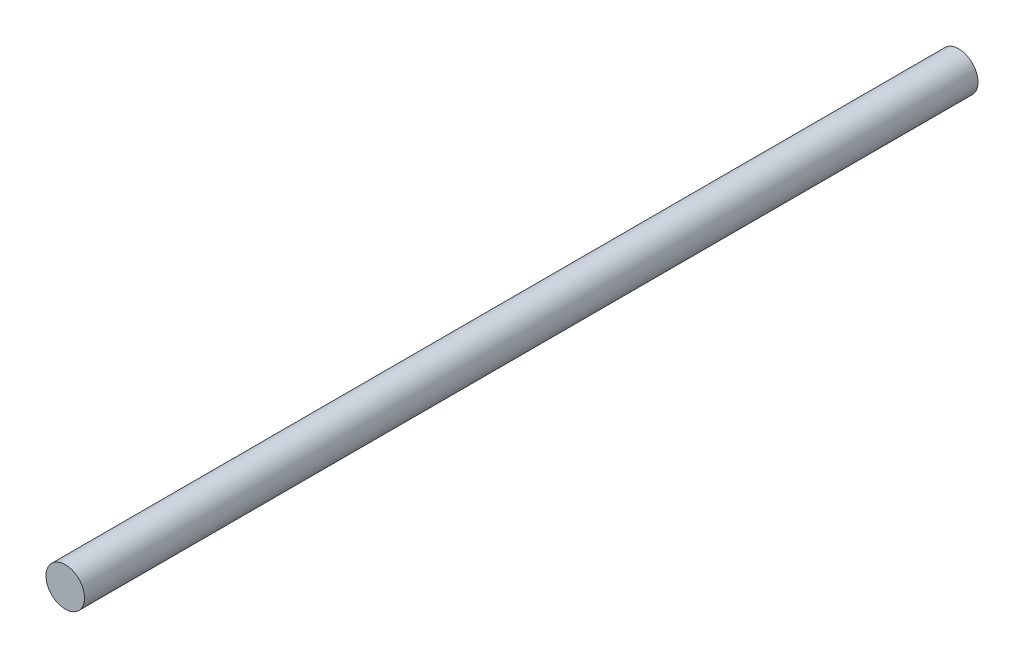
from build123d import *

# Parameters (mm, degrees)
SKETCH_1_R      = 3
EXTRUDE_1_DEPTH = 139


with BuildPart() as part:
    # 草图1 → 凸台-拉伸1 (new body)
    with BuildSketch(Plane.XY):
        Circle(SKETCH_1_R)
    extrude(amount=EXTRUDE_1_DEPTH)


solid = part.part
